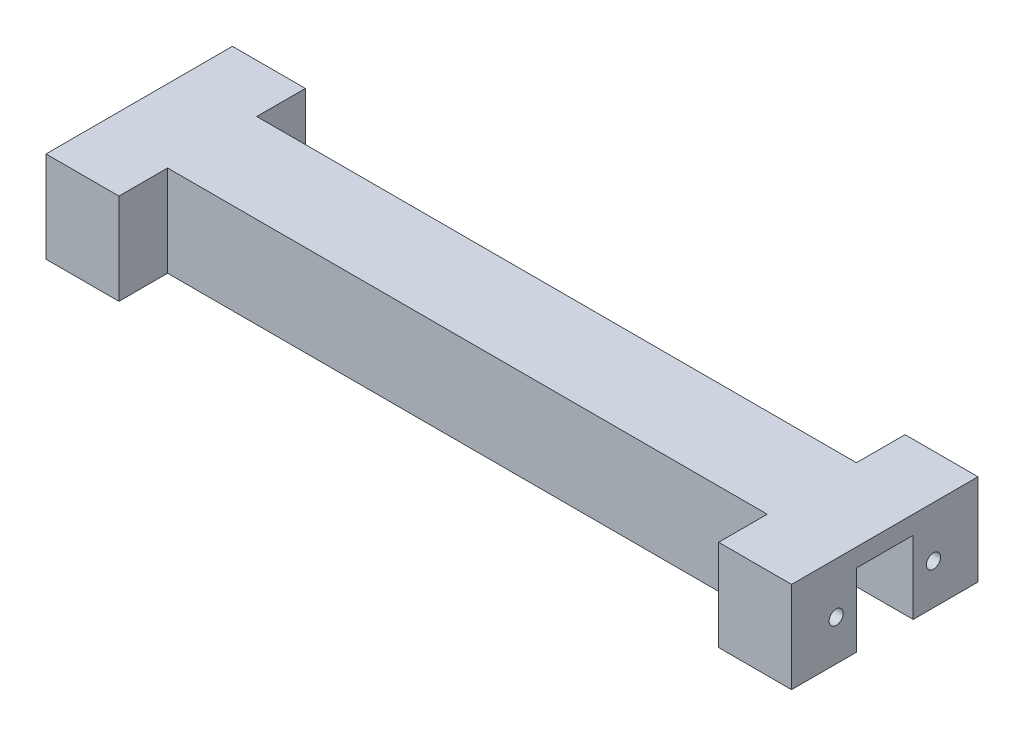
from build123d import *

# Parameters (mm, degrees)
SKETCH1_W           = 183.96444
SKETCH1_H           = 22
BOSS_EXTRUDE1_DEPTH = 22.5
SKETCH2_W           = 183.96444
SKETCH2_H           = 14
CUT_EXTRUDE1_DEPTH  = 18
SKETCH3_W           = 18
SKETCH3_H           = 22.5
BOSS_EXTRUDE2_DEPTH = 12
SKETCH4_W           = 18
SKETCH4_H           = 22.5
BOSS_EXTRUDE3_DEPTH = 12
SKETCH5_R           = 1.7526
CUT_EXTRUDE2_DEPTH  = 16
CUT_EXTRUDE3_START  = -16
SKETCH6_R           = 1.7526
CUT_EXTRUDE3_DEPTH  = 16


with BuildPart() as part:
    # Sketch1 → Boss-Extrude1 (new body)
    with BuildSketch(Plane(origin=(0, 0, 0), x_dir=(1, 0, 0), z_dir=(0, 1, 0))):
        Rectangle(SKETCH1_W, SKETCH1_H)
    extrude(amount=BOSS_EXTRUDE1_DEPTH)

    # Sketch2 → Cut-Extrude1 (cut)
    with BuildSketch(Plane.XZ):
        Rectangle(SKETCH2_W, SKETCH2_H)
    extrude(amount=-CUT_EXTRUDE1_DEPTH, mode=Mode.SUBTRACT)

    # Sketch3 → Boss-Extrude2 (add)
    with BuildSketch(Plane.XY.offset(11)):
        with Locations((-82.98222, 11.25)):
            Rectangle(SKETCH3_W, SKETCH3_H)
        with Locations((82.98222, 11.25)):
            Rectangle(SKETCH3_W, SKETCH3_H)
    extrude(amount=BOSS_EXTRUDE2_DEPTH)

    # Sketch4 → Boss-Extrude3 (add)
    with BuildSketch(Plane(origin=(0, 0, -11), x_dir=(-1, 0, 0), z_dir=(0, 0, -1))):
        with Locations((-82.98222, 11.25)):
            Rectangle(SKETCH4_W, SKETCH4_H)
        with Locations((82.98222, 11.25)):
            Rectangle(SKETCH4_W, SKETCH4_H)
    extrude(amount=BOSS_EXTRUDE3_DEPTH)

    # Sketch5 → Cut-Extrude2 (cut)
    with BuildSketch(Plane(origin=(91.98222, 0, 0), x_dir=(0, 0, -1), z_dir=(1, 0, 0))):
        with Locations((-12, 10)):
            Circle(SKETCH5_R)
        with Locations((12, 10)):
            Circle(SKETCH5_R)
    extrude(amount=-CUT_EXTRUDE2_DEPTH, mode=Mode.SUBTRACT)

    # Sketch6 → Cut-Extrude3 (cut)
    with BuildSketch(Plane.ZY.offset(91.98222).offset(CUT_EXTRUDE3_START)):
        with Locations(Location((-12, 10, 0), (0, 0, 180))):
            Circle(SKETCH6_R)
        with Locations(Location((12, 10, 0), (0, 0, 180))):
            Circle(SKETCH6_R)
    extrude(amount=CUT_EXTRUDE3_DEPTH, mode=Mode.SUBTRACT)


solid = part.part
